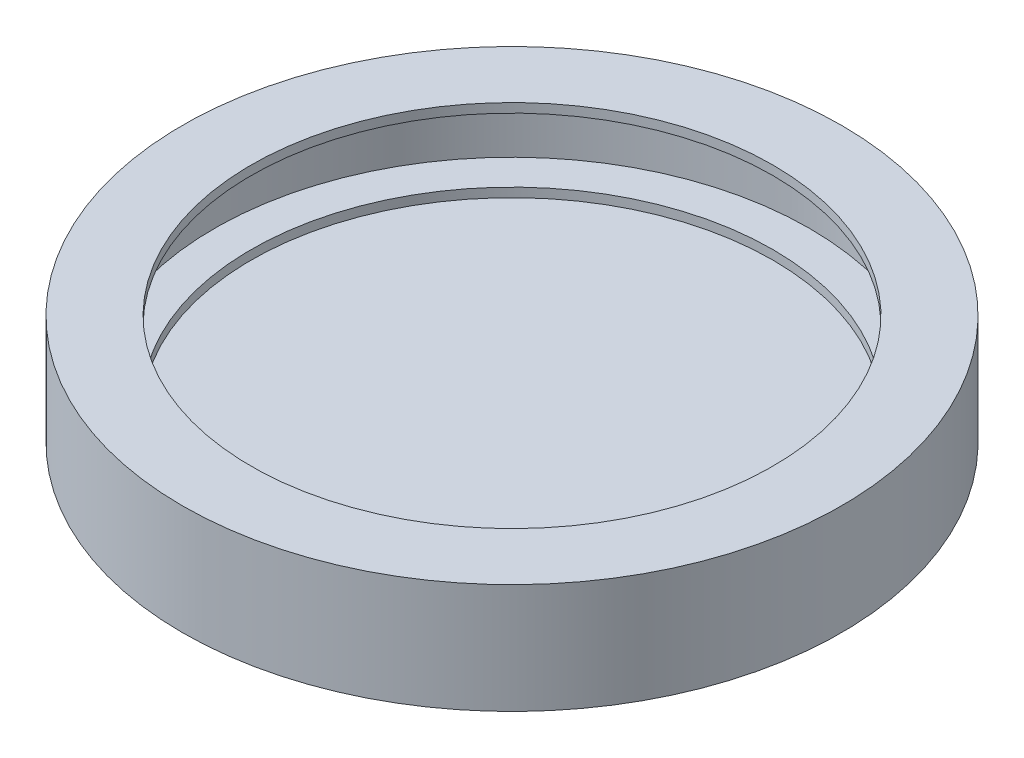
from build123d import *


with BuildPart() as part:
    # Sketch1 → Revolve1 (revolve)
    with BuildSketch(Plane(origin=(0, 0, 0), x_dir=(0, 0, -1), z_dir=(1, 0, 0)), mode=Mode.PRIVATE) as revolve1_sk:
        Polygon((0, 0), (0, 3), (-28.5, 3), (-28.5, 4), (-32.5, 4), (-32.5, 11), (-28.5, 11), (-28.5, 12), (-36, 12), (-36, 0), align=None)
    revolve(revolve1_sk.sketch.rotate(Axis((0, 0, 0), (0, 1, 0)), 180), axis=Axis((0, 0, 0), (0, 1, 0)))


solid = part.part
